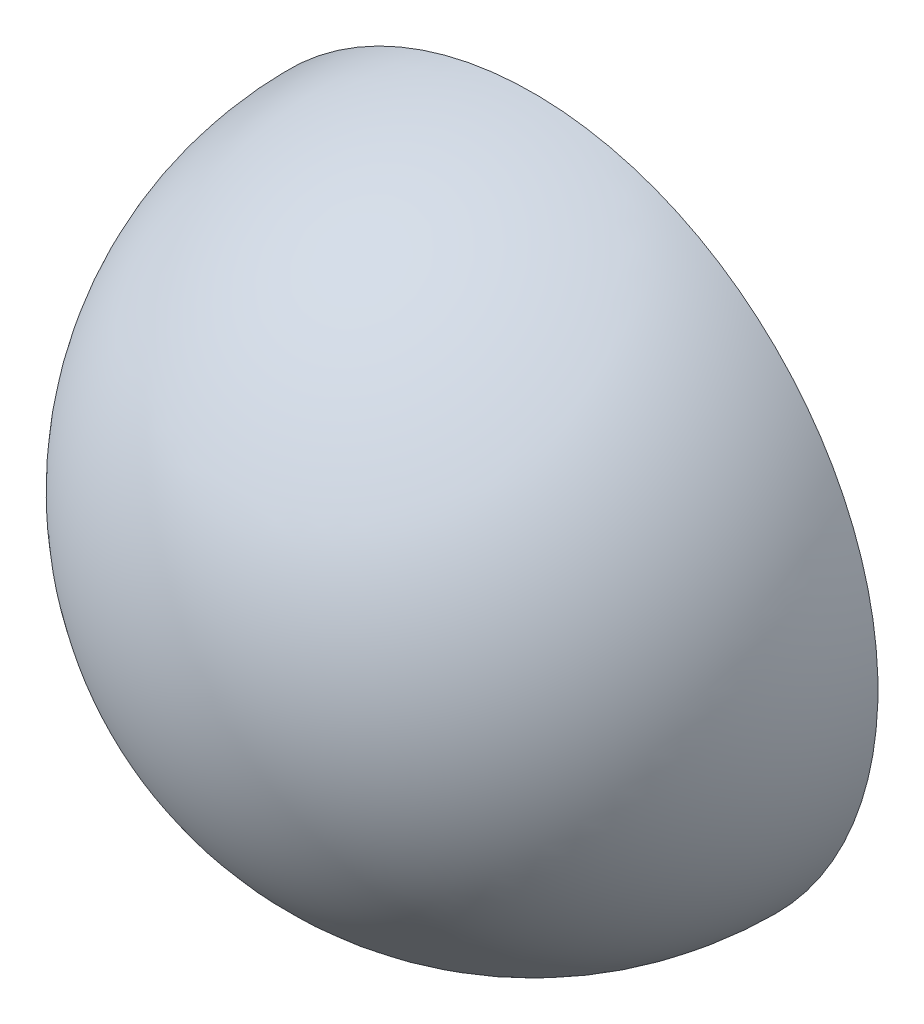
from build123d import *

# Parameters (mm, degrees)
REVOLVE_3_ANGLE = 180


with BuildPart() as part:
    # 草图1 → 旋转3 (revolve)
    with BuildSketch(Plane.XY):
        with BuildLine():
            Line((0, 60), (0, 58))
            ThreePointArc((0, 58), (58, 0), (0, -58))
            Line((0, -58), (0, -60))
            ThreePointArc((0, -60), (60, 0), (0, 60))
        make_face()
    revolve(axis=Axis((0, 60, 0), (0, -1, 0)), revolution_arc=REVOLVE_3_ANGLE)


solid = part.part
